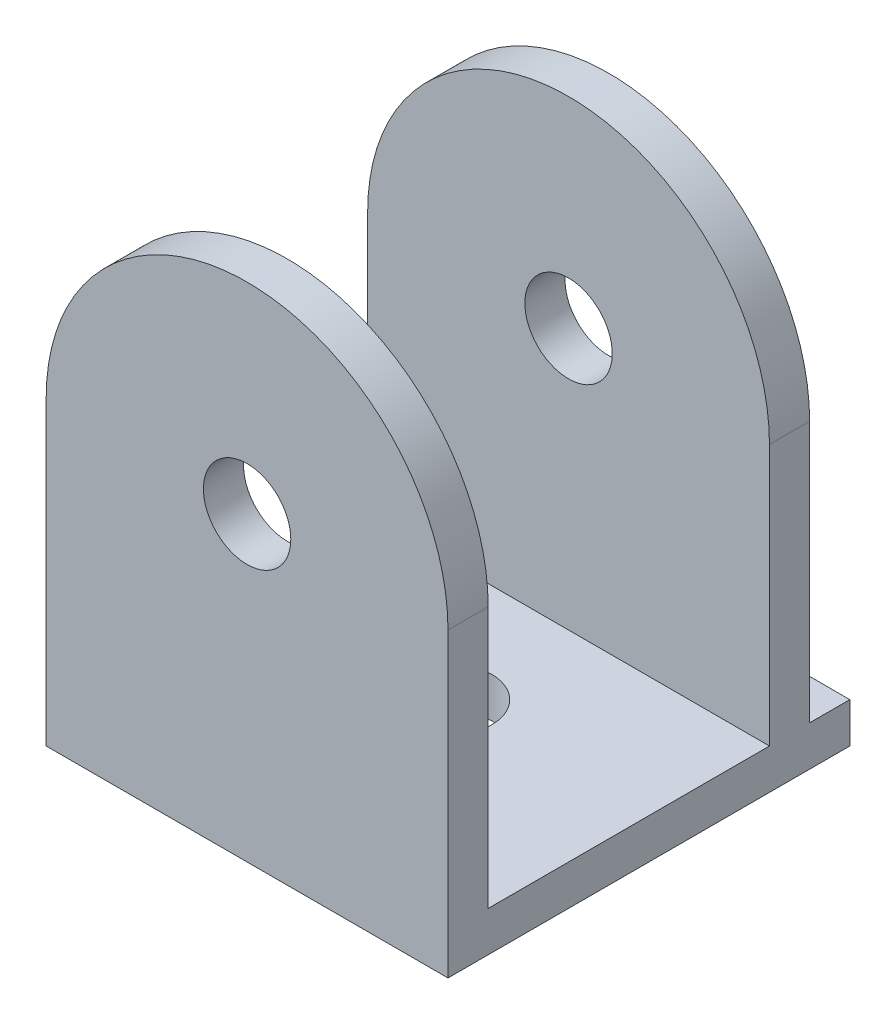
from build123d import *

# Parameters (mm, degrees)
SKETCH1_W               = 40
SKETCH1_H               = 30
BOSS_EXTRUDE1_DEPTH     = 20
CUT_EXTRUDE1_DEPTH      = 58.445626465
CUT_EXTRUDE1_DEPTH_BACK = 58.445626465
SKETCH2_W               = 28
SKETCH2_H               = 46
SKETCH2_W_2             = 4
CUT_EXTRUDE2_DEPTH      = 68.082039325
CUT_EXTRUDE2_DEPTH_BACK = 68.082039325
SKETCH3_R               = 4.35
SKETCH4_R               = 4.35
CUT_EXTRUDE3_DEPTH      = 58.445626465


with BuildPart() as part:
    # Sketch1 → Boss-Extrude1 (new, symmetric)
    with BuildSketch(Plane.XY):
        with BuildLine():
            ThreePointArc((-20, 30), (0, 50), (20, 30))
            Line((20, 30), (-20, 30))
        make_face()
        with Locations((0, 15)):
            Rectangle(SKETCH1_W, SKETCH1_H)
    extrude(amount=BOSS_EXTRUDE1_DEPTH, both=True)

    # Sketch2 → Cut-Extrude1 (cut, two sides: drawn at the far end of the back side and taken through both)
    with BuildSketch(Plane(origin=(0, 0, 0), x_dir=(0, 0, -1), z_dir=(1, 0, 0)).offset(-CUT_EXTRUDE1_DEPTH_BACK)):
        with Locations((-2, 27)):
            Rectangle(SKETCH2_W, SKETCH2_H)
        with Locations((18, 27)):
            Rectangle(SKETCH2_W_2, SKETCH2_H)
    extrude(amount=CUT_EXTRUDE1_DEPTH + CUT_EXTRUDE1_DEPTH_BACK, mode=Mode.SUBTRACT)

    # Sketch3 → Cut-Extrude2 (cut, two sides: drawn at the far end of the back side and taken through both)
    with BuildSketch(Plane.XY.offset(20).offset(-CUT_EXTRUDE2_DEPTH_BACK)):
        with Locations(Location((0, 30, 0), (0, 0, 90))):
            Circle(SKETCH3_R)
    extrude(amount=CUT_EXTRUDE2_DEPTH + CUT_EXTRUDE2_DEPTH_BACK, mode=Mode.SUBTRACT)

    # Sketch4 → Cut-Extrude3 (cut, through all)
    with BuildSketch(Plane.XZ):
        with Locations(Location((0, 0, 0), (0, 0, 270))):
            Circle(SKETCH4_R)
    extrude(amount=-CUT_EXTRUDE3_DEPTH, mode=Mode.SUBTRACT)


solid = part.part
